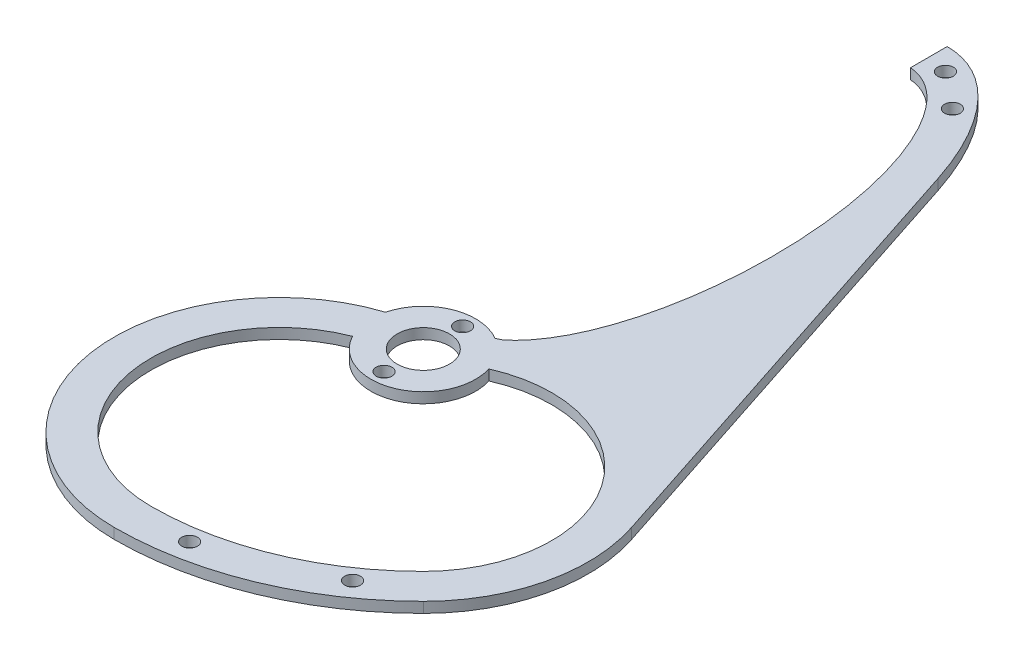
from build123d import *

# Parameters (mm, degrees)
SKETCH_1_R          = 1.5
SKETCH_1_R_2        = 5
EXTRUDE_1_DEPTH     = 2
SKETCH_2_R          = 1.5
CUT_EXTRUDE_1_DEPTH = 113.24721613


with BuildPart() as part:
    # Эскиз1 → Бобышка-Вытянуть1 (new body)
    with BuildSketch(Plane(origin=(0, 0, 0), x_dir=(1, 0, 0), z_dir=(0, 1, 0))):
        with BuildLine():
            Line((20.920510558, 77.368874006), (49.384544256, -9.652590843))
            ThreePointArc((49.384544256, -9.652590843), (50.082294278, -26.768888156), (41.71930009, -41.71930009))
            ThreePointArc((41.71930009, -41.71930009), (22.57832251, -54.508892418), (0, -59))
            ThreePointArc((0, -59), (-31.115839287, -32.404543348), (-9.689459213, 2.472727273))
            ThreePointArc((-9.689459213, 2.472727273), (-3.826834324, 9.238795325), (5.103000093, 8.599964538))
            ThreePointArc((5.103000093, 8.599964538), (5.56584167, 8.831883897), (6.032432156, 9.056165489))
            add(Edge.make_bspline(
                [(6.032432156, 9.056165489), (20.333058311, 20.174697248), (17.754834495, 56.051767679), (15.176610679, 91.928838109), (0, 93)],
                knots=[3.447165174, 3.447165174, 3.447165174, 4.847252186, 4.847252186, 6.247339197, 6.247339197, 6.247339197], degree=2, weights=[1, 0.764814159, 1, 0.764814159, 1]))
            Line((0, 93), (0, 100))
            add(Edge.make_bspline(
                [(20.920510558, 77.368874006), (13.519104954, 99.996768719), (0, 100)],
                knots=[5.291576489, 5.291576489, 5.291576489, 6.283025963, 6.283025963, 6.283025963], degree=2, weights=[1, 0.879624206, 1]))
        make_face()
        with Locations(Location((9.550649772, -54.164426416, 0), (0, 0, 270))):
            Circle(SKETCH_1_R, mode=Mode.SUBTRACT)
        with Locations(Location((31.546703999, -45.053362436, 0), (0, 0, 90))):
            Circle(SKETCH_1_R, mode=Mode.SUBTRACT)
        with Locations(Location((0, 0, 0), (0, 0, 270))):
            Circle(SKETCH_1_R_2, mode=Mode.SUBTRACT)
        with Locations(Location((0, -7.5, 0), (0, 0, 270))):
            Circle(SKETCH_1_R, mode=Mode.SUBTRACT)
        with Locations(Location((0, 7.5, 0), (0, 0, 270))):
            Circle(SKETCH_1_R, mode=Mode.SUBTRACT)
        with BuildLine():
            ThreePointArc((0, -52), (19.899538483, -48.041735691), (36.769552622, -36.769552622))
            ThreePointArc((36.769552622, -36.769552622), (39.657964622, -5.59972573), (9.54966327, 2.967141962))
            ThreePointArc((9.54966327, 2.967141962), (7.071067812, -7.071067812), (-2.967141962, -9.54966327))
            ThreePointArc((-2.967141962, -9.54966327), (-6.395779647, -7.687262368), (-8.850717859, -4.654545455))
            ThreePointArc((-8.850717859, -4.654545455), (-24.082811675, -32.002019749), (0, -52))
        make_face(mode=Mode.SUBTRACT)
    extrude(amount=EXTRUDE_1_DEPTH)

    # Эскиз2 → Вырез-Вытянуть1 (cut, through all)
    with BuildSketch(Plane.XZ):
        with Locations(Location((3.997292475, -95.689262056, 0), (0, 0, 270))):
            Circle(SKETCH_2_R)
        with Locations(Location((10.780229305, -90.232363482, 0), (0, 0, 270))):
            Circle(SKETCH_2_R)
    extrude(amount=-CUT_EXTRUDE_1_DEPTH, mode=Mode.SUBTRACT)


solid = part.part
